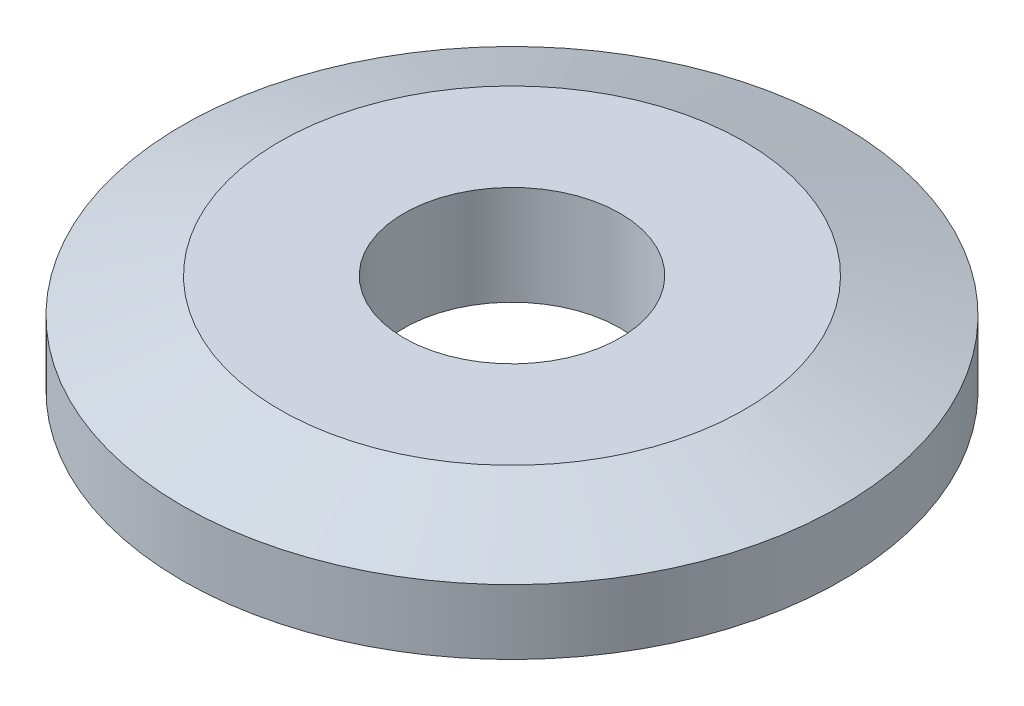
from build123d import *


with BuildPart() as part:
    # Sketch1 → Revolve1 (revolve)
    with BuildSketch(Plane.XY, mode=Mode.PRIVATE) as revolve1_sk:
        Polygon((2.54, 0), (2.54, 2.3368), (5.461, 2.3368), (7.747, 1.524), (7.747, 0), align=None)
    revolve(revolve1_sk.sketch.rotate(Axis((0, 0, 0), (0, 1, 0)), 90), axis=Axis((0, 0, 0), (0, 1, 0)))


solid = part.part
